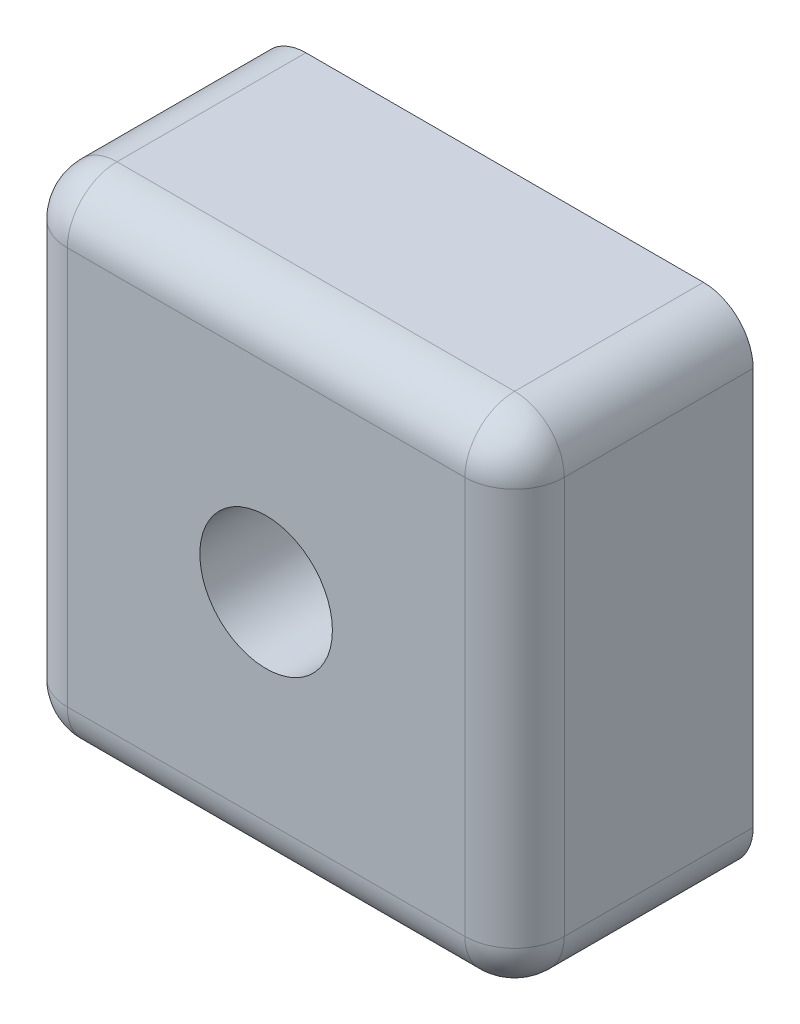
from build123d import *

# Parameters (mm, degrees)
EXTRUDE_1_DEPTH = 48
FILLET_2_R      = 10
FILLET_3_R      = 10


with BuildPart() as part:
    # 草图1 → 凸台-拉伸1 (new body)
    with BuildSketch(Plane.XY):
        with BuildLine():
            Line((-50, 50), (-50, -50))
            Line((-50, -50), (0, -50))
            Line((0, -50), (0, -20.9))
            ThreePointArc((0, -20.9), (-20.9, 0), (0, 20.9))
            Line((0, 20.9), (0, 50))
            Line((0, 50), (-50, 50))
        make_face()
        with BuildLine():
            Line((50, 50), (0, 50))
            Line((0, 50), (0, 20.9))
            ThreePointArc((0, 20.9), (14.778531727, 14.778531727), (20.9, 0))
            Line((20.9, 0), (50, 0))
            Line((50, 0), (50, 50))
        make_face()
        with BuildLine():
            Line((0, -13.339839146), (0, -20.9))
            ThreePointArc((0, -20.9), (14.778531727, -14.778531727), (20.9, 0))
            Line((20.9, 0), (13.339839146, 0))
            ThreePointArc((13.339839146, 0), (9.43269072, -9.43269072), (0, -13.339839146))
        make_face()
        with BuildLine():
            ThreePointArc((20.9, 0), (14.778531727, 14.778531727), (0, 20.9))
            Line((0, 20.9), (0, 13.339839146))
            ThreePointArc((0, 13.339839146), (9.43269072, 9.43269072), (13.339839146, 0))
            Line((13.339839146, 0), (20.9, 0))
        make_face()
        with BuildLine():
            ThreePointArc((0, 20.9), (-20.9, 0), (0, -20.9))
            Line((0, -20.9), (0, -13.339839146))
            ThreePointArc((0, -13.339839146), (-13.339839146, 0), (0, 13.339839146))
            Line((0, 13.339839146), (0, 20.9))
        make_face()
        with BuildLine():
            Line((0, -20.9), (0, -50))
            Line((0, -50), (50, -50))
            Line((50, -50), (50, 0))
            Line((50, 0), (20.9, 0))
            ThreePointArc((20.9, 0), (14.778531727, -14.778531727), (0, -20.9))
        make_face()
    extrude(amount=EXTRUDE_1_DEPTH)

    # 圆角2
    fillet_2_edges = [part.edges().sort_by_distance(p)[0] for p in [
        (50, -50, 24),
        (-50, -50, 24),
        (-50, 50, 24),
        (50, 50, 24),
    ]]
    fillet(fillet_2_edges, radius=FILLET_2_R)

    # 圆角3
    fillet_3_edges = [part.edges().sort_by_distance(p)[0] for p in [
        (0, -50, 48),
        (-50, 0, 48),
        (50, 0, 48),
        (0, 50, 48),
        (-47.071067812, 47.071067812, 48),
        (47.071067812, 47.071067812, 48),
        (47.071067812, -47.071067812, 48),
        (-47.071067812, -47.071067812, 48),
    ]]
    fillet(fillet_3_edges, radius=FILLET_3_R)


solid = part.part
